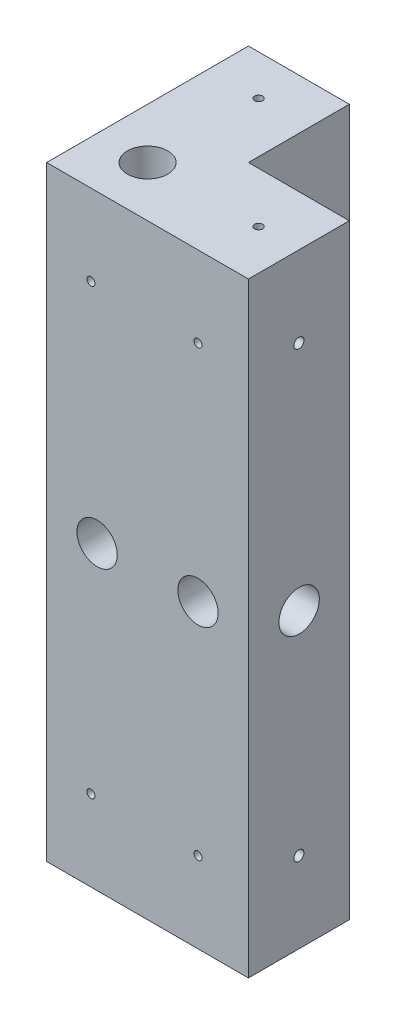
from build123d import *

# Parameters (mm, degrees)
BOSS_EXTRUDE1_DEPTH     = 150
CUT_EXTRUDE1_DEPTH      = 150
CUT_EXTRUDE1_DEPTH_BACK = 150
SKETCH2_R               = 1.25
SKETCH2_R_2             = 5
CUT_EXTRUDE2_DEPTH      = 150
CUT_EXTRUDE2_DEPTH_BACK = 150
SKETCH3_R               = 1
SKETCH3_R_2             = 5
CUT_EXTRUDE3_DEPTH      = 150
CUT_EXTRUDE3_DEPTH_BACK = 150
SKETCH4_R               = 1
SKETCH4_R_2             = 5
SKETCH5_R               = 1
CUT_EXTRUDE4_DEPTH      = 150
CUT_EXTRUDE5_DEPTH      = 150
CUT_EXTRUDE5_DEPTH_BACK = 150
SKETCH5_2_R             = 1


with BuildPart() as part:
    # Sketch1 → Boss-Extrude1 (new body)
    with BuildSketch(Plane(origin=(0, 0, 0), x_dir=(1, 0, 0), z_dir=(0, 1, 0))):
        Polygon((0, 0), (0, 50), (25, 50), (25, 25), (50, 25), (50, 0), align=None)
    extrude(amount=BOSS_EXTRUDE1_DEPTH)

    # Sketch2 → Cut-Extrude1 (cut, two sides: drawn at the far end of the back side and taken through both)
    with BuildSketch(Plane(origin=(0, 0, 0), x_dir=(0, 0, -1), z_dir=(1, 0, 0)).offset(-CUT_EXTRUDE1_DEPTH_BACK)):
        with Locations((12.5, 130)):
            Circle(SKETCH2_R)
        with Locations((12.5, 20)):
            Circle(SKETCH2_R)
        with Locations((12.55528785, 72.539998761)):
            Circle(SKETCH2_R_2)
        with Locations((37.5, 130)):
            Circle(SKETCH2_R)
        with Locations((37.5, 20)):
            Circle(SKETCH2_R)
        with Locations((38.969679584, 72.539998761)):
            Circle(SKETCH2_R_2)
    extrude(amount=CUT_EXTRUDE1_DEPTH + CUT_EXTRUDE1_DEPTH_BACK, mode=Mode.SUBTRACT)

    # Sketch3 → Cut-Extrude2 (cut, two sides: drawn at the far end of the back side and taken through both)
    with BuildSketch(Plane(origin=(0, 0, 0), x_dir=(1, 0, 0), z_dir=(0, 1, 0)).offset(-CUT_EXTRUDE2_DEPTH_BACK)):
        with Locations((12.5, 40)):
            Circle(SKETCH3_R)
        with Locations((40, 12.5)):
            Circle(SKETCH3_R)
        with Locations((12.5, 12.5)):
            Circle(SKETCH3_R_2)
    extrude(amount=CUT_EXTRUDE2_DEPTH + CUT_EXTRUDE2_DEPTH_BACK, mode=Mode.SUBTRACT)

    # Sketch4 → Cut-Extrude3 (cut, two sides: drawn at the far end of the back side and taken through both)
    with BuildSketch(Plane(origin=(0, 0, -25), x_dir=(-1, 0, 0), z_dir=(0, 0, -1)).offset(-CUT_EXTRUDE3_DEPTH_BACK)):
        with Locations((-37.5, 130)):
            Circle(SKETCH4_R)
        with Locations((-37.5, 20)):
            Circle(SKETCH4_R)
        with Locations((-37.5, 74.522470348)):
            Circle(SKETCH4_R_2)
        with Locations((-12.5, 74.522470348)):
            Circle(SKETCH4_R_2)
    extrude(amount=CUT_EXTRUDE3_DEPTH + CUT_EXTRUDE3_DEPTH_BACK, mode=Mode.SUBTRACT)

    # Sketch5 → Cut-Extrude4 (cut)
    with BuildSketch(Plane(origin=(0, 0, -25), x_dir=(-1, 0, 0), z_dir=(0, 0, -1))):
        with Locations((-10.98075733, 130)):
            Circle(SKETCH5_R)
        with Locations((-10.98075733, 20)):
            Circle(SKETCH5_R)
    extrude(amount=-CUT_EXTRUDE4_DEPTH, mode=Mode.SUBTRACT)

    # Sketch5<2> → Cut-Extrude5 (cut, two sides: drawn at the far end of the back side and taken through both)
    with BuildSketch(Plane(origin=(0, 0, -25), x_dir=(-1, 0, 0), z_dir=(0, 0, -1)).offset(-CUT_EXTRUDE5_DEPTH_BACK)):
        with Locations((-10.98075733, 130)):
            Circle(SKETCH5_2_R)
        with Locations((-10.98075733, 20)):
            Circle(SKETCH5_2_R)
    extrude(amount=CUT_EXTRUDE5_DEPTH + CUT_EXTRUDE5_DEPTH_BACK, mode=Mode.SUBTRACT)


solid = part.part
